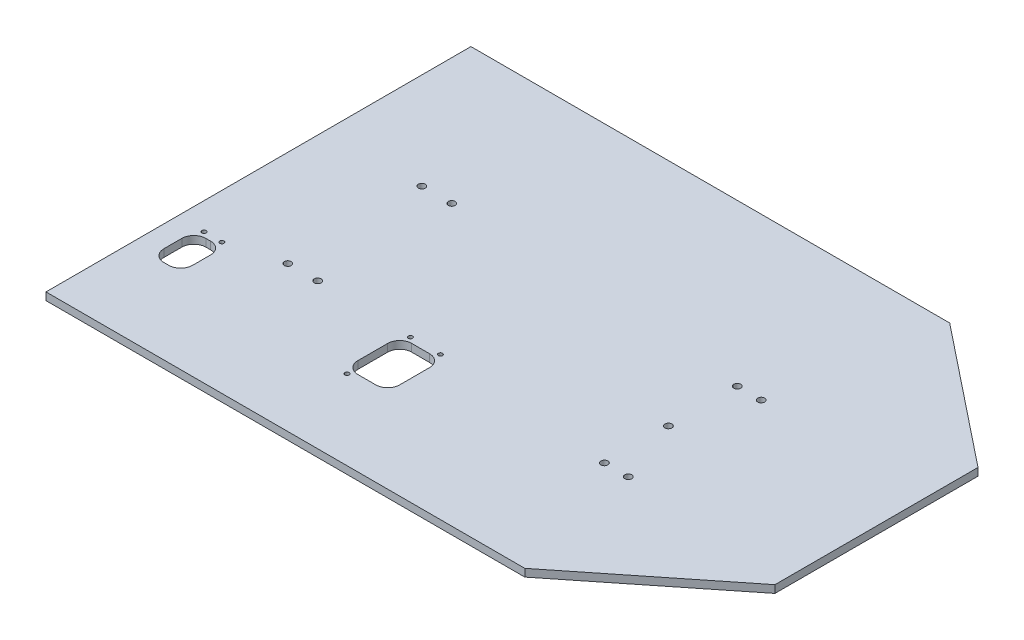
from build123d import *

# Parameters (mm, degrees)
SKETCH1_W            = 355
SKETCH1_H            = 6.35
BOSS_EXTRUDE1_DEPTH  = 200
SKETCH28_R           = 1.75
RELIEF_CUTS_DEPTH    = 10
M5_CLEARANCE_HOLE1_D = 5.8
BOSS_EXTRUDE2_DEPTH  = 6.35


with BuildPart() as part:
    # Sketch1 → Boss-Extrude1 (new, symmetric)
    with BuildSketch(Plane(origin=(0, 0, 0), x_dir=(0, 0, -1), z_dir=(1, 0, 0))):
        with Locations((0, -3.175)):
            Rectangle(SKETCH1_W, SKETCH1_H)
    extrude(amount=BOSS_EXTRUDE1_DEPTH, both=True)

    # Sketch28 → Relief Cuts (cut)
    with BuildSketch(Plane(origin=(0, 0, 0), x_dir=(-1, 0, 0), z_dir=(0, 1, 0))):
        with Locations(Location((15, 111, 0), (0, 0, 90))):
            Circle(SKETCH28_R)
        with Locations(Location((15, 58, 0), (0, 0, 90))):
            Circle(SKETCH28_R)
        with Locations(Location((-10, 58, 0), (0, 0, 90))):
            Circle(SKETCH28_R)
        with Locations(Location((162.5, 68, 0), (0, 0, 90))):
            Circle(SKETCH28_R)
        with Locations(Location((177.5, 68, 0), (0, 0, 90))):
            Circle(SKETCH28_R)
        with BuildLine():
            Line((10, 62), (-5, 62))
            ThreePointArc((-5, 62), (-12.071067812, 64.928932188), (-15, 72))
            Line((-15, 72), (-15, 97))
            ThreePointArc((-15, 97), (-12.071067812, 104.071067812), (-5, 107))
            Line((-5, 107), (10, 107))
            ThreePointArc((10, 107), (17.071067812, 104.071067812), (20, 97))
            Line((20, 97), (20, 72))
            ThreePointArc((20, 72), (17.071067812, 64.928932188), (10, 62))
        make_face()
        with BuildLine():
            Line((168, 107), (172, 107))
            ThreePointArc((172, 107), (179.071067812, 104.071067812), (182, 97))
            Line((182, 97), (182, 82))
            ThreePointArc((182, 82), (179.071067812, 74.928932188), (172, 72))
            Line((172, 72), (168, 72))
            ThreePointArc((168, 72), (160.928932188, 74.928932188), (158, 82))
            Line((158, 82), (158, 97))
            ThreePointArc((158, 97), (160.928932188, 104.071067812), (168, 107))
        make_face()
    extrude(amount=-RELIEF_CUTS_DEPTH, mode=Mode.SUBTRACT)

    # M5 Clearance Hole1 (through all)
    with Locations(Plane(origin=(0, 0, 0), x_dir=(1, 0, 0), z_dir=(0, 1, 0))):
        with Locations((-119.5, 56), (-94.5, 56), (-94.5, -56), (-119.5, -56), (157, -68), (157, -14.5), (157, 43), (177, 43), (177, -68)):
            Hole(M5_CLEARANCE_HOLE1_D / 2)

    # Sketch33 → Boss-Extrude2 (add)
    with BuildSketch(Plane(origin=(0, 0, 0), x_dir=(1, 0, 0), z_dir=(0, 1, 0))):
        Polygon((200, 177.5), (200, -177.5), (316.322865072, -84.817675973), (316.322865072, 84.817675973), align=None)
    extrude(amount=-BOSS_EXTRUDE2_DEPTH)


solid = part.part
